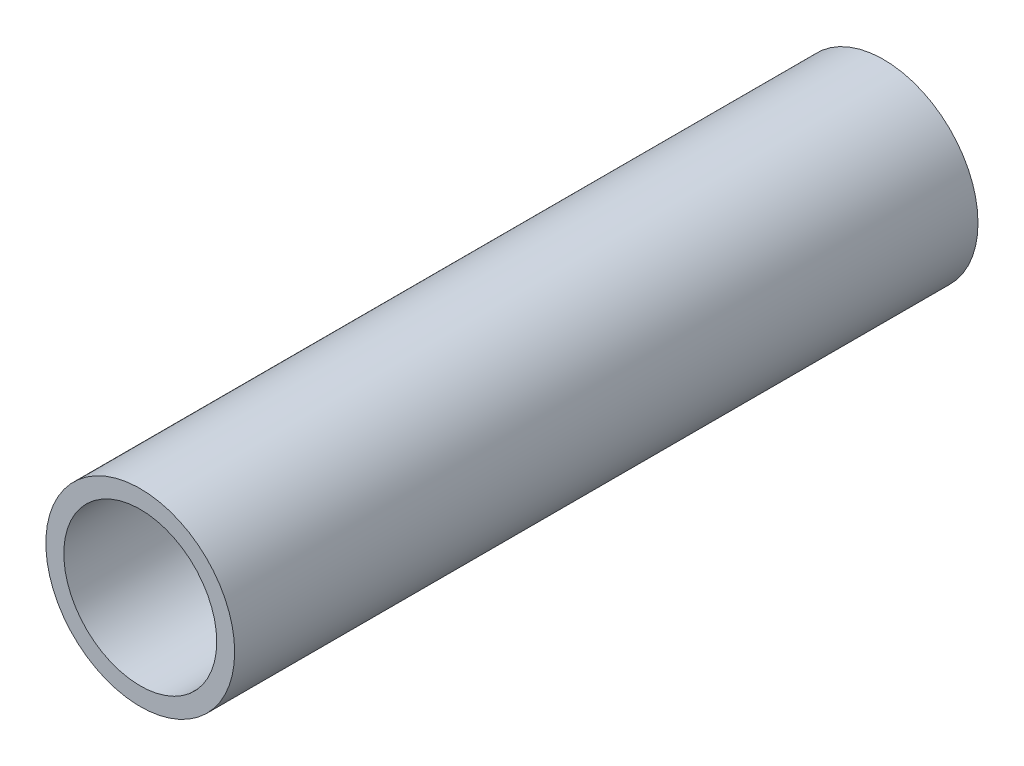
from build123d import *

# Parameters (mm, degrees)
SKETCH3_R           = 12.7
SKETCH3_R_2         = 10.287
BOSS_EXTRUDE1_DEPTH = 100


with BuildPart() as part:
    # Sketch3 → Boss-Extrude1 (new body)
    with BuildSketch(Plane.XY):
        Circle(SKETCH3_R)
        Circle(SKETCH3_R_2, mode=Mode.SUBTRACT)
    extrude(amount=BOSS_EXTRUDE1_DEPTH)


solid = part.part
